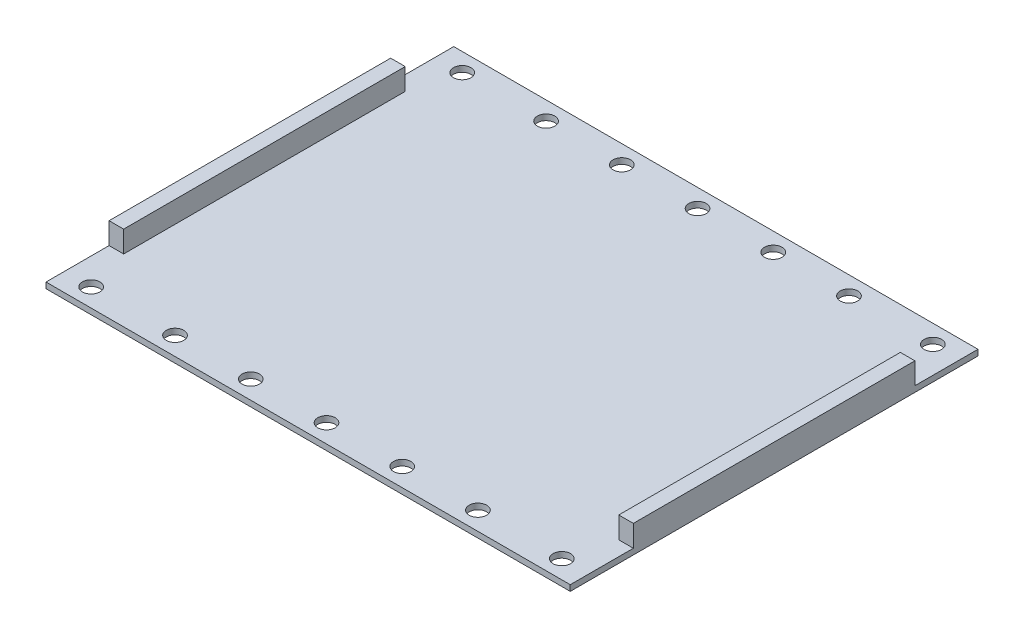
from build123d import *

# Parameters (mm, degrees)
SKETCH_1_W                 = 90
SKETCH_1_H                 = 70
SKETCH_1_R                 = 1.5
EXTRUDE_1_DEPTH            = 1
SKETCH_2_W                 = 2.5
SKETCH_2_H                 = 48.34
EXTRUDE_2_DEPTH            = 3.7
SKETCH_4_R                 = 1.5
CUT_EXTRUDE_1_DEPTH        = 10
PATTERN_LINEAR_1_COUNT     = 3
PATTERN_LINEAR_1_PITCH     = 13
PATTERN_LINEAR_1_COL_COUNT = 3
PATTERN_LINEAR_1_COL_PITCH = 13
MIRROR_2_COPY_1_SKETCH_R   = 1.5
MIRROR_2_COPY_1_DEPTH      = 10
MIRROR_2_COPY_2_SKETCH_R   = 1.5
MIRROR_2_COPY_2_DEPTH      = 10
MIRROR_2_COPY_3_SKETCH_R   = 1.5
MIRROR_2_COPY_3_DEPTH      = 10
MIRROR_2_COPY_4_SKETCH_R   = 1.5
MIRROR_2_COPY_4_DEPTH      = 10


with BuildPart() as part:
    # 草图1 → 凸台-拉伸1 (new body)
    with BuildSketch(Plane(origin=(0, 0, 0), x_dir=(1, 0, 0), z_dir=(0, 1, 0))):
        Rectangle(SKETCH_1_W, SKETCH_1_H)
        with Locations(Location((40.4, -31.85, 0), (0, 0, 270))):
            Circle(SKETCH_1_R, mode=Mode.SUBTRACT)
        with Locations(Location((-40.4, -31.85, 0), (0, 0, 90))):
            Circle(SKETCH_1_R, mode=Mode.SUBTRACT)
        with Locations(Location((40.4, 31.85, 0), (0, 0, 90))):
            Circle(SKETCH_1_R, mode=Mode.SUBTRACT)
        with Locations(Location((-40.4, 31.85, 0), (0, 0, 270))):
            Circle(SKETCH_1_R, mode=Mode.SUBTRACT)
    extrude(amount=EXTRUDE_1_DEPTH)

    # 草图2 → 凸台-拉伸2 (add)
    with BuildSketch(Plane(origin=(0, 1, 0), x_dir=(1, 0, 0), z_dir=(0, 1, 0))):
        with Locations((43.75, 0)):
            Rectangle(SKETCH_2_W, SKETCH_2_H)
    extrude_2 = extrude(amount=EXTRUDE_2_DEPTH)

    # 镜向1: 凸台-拉伸2 across plane
    add(extrude_2.mirror(Plane(origin=(0, 0, 0), x_dir=(0, 0, 1), z_dir=(1, 0, 0))))

    # 草图4 → 切除-拉伸1 (cut)
    with BuildSketch(Plane.XZ):
        with Locations(Location((0, 31.85, 0), (0, 0, 270))):
            Circle(SKETCH_4_R)
    cut_extrude_1 = extrude(amount=-CUT_EXTRUDE_1_DEPTH, mode=Mode.SUBTRACT)

    # 阵列(线性)1: 切除-拉伸1 ×3
    with Locations(*[(-i * PATTERN_LINEAR_1_PITCH, 0, 0) for i in range(1, PATTERN_LINEAR_1_COUNT)]):
        add(cut_extrude_1, mode=Mode.SUBTRACT)

    # 阵列(线性)1 col: 切除-拉伸1 ×3
    with Locations(*[(i * PATTERN_LINEAR_1_COL_PITCH, 0, 0) for i in range(1, PATTERN_LINEAR_1_COL_COUNT)]):
        add(cut_extrude_1, mode=Mode.SUBTRACT)

    # 镜向2: 切除-拉伸1 across plane
    add(cut_extrude_1.mirror(Plane.XY), mode=Mode.SUBTRACT)

    # 镜向2 copy 1 sketch → 镜向2 copy 1 (cut)
    with BuildSketch(Plane(origin=(-13, 0, 0), x_dir=(1, 0, 0), z_dir=(0, -1, 0))):
        with Locations((0, -31.85)):
            Circle(MIRROR_2_COPY_1_SKETCH_R)
    extrude(amount=-MIRROR_2_COPY_1_DEPTH, mode=Mode.SUBTRACT)

    # 镜向2 copy 2 sketch → 镜向2 copy 2 (cut)
    with BuildSketch(Plane(origin=(-26, 0, 0), x_dir=(1, 0, 0), z_dir=(0, -1, 0))):
        with Locations((0, -31.85)):
            Circle(MIRROR_2_COPY_2_SKETCH_R)
    extrude(amount=-MIRROR_2_COPY_2_DEPTH, mode=Mode.SUBTRACT)

    # 镜向2 copy 3 sketch → 镜向2 copy 3 (cut)
    with BuildSketch(Plane(origin=(13, 0, 0), x_dir=(1, 0, 0), z_dir=(0, -1, 0))):
        with Locations((0, -31.85)):
            Circle(MIRROR_2_COPY_3_SKETCH_R)
    extrude(amount=-MIRROR_2_COPY_3_DEPTH, mode=Mode.SUBTRACT)

    # 镜向2 copy 4 sketch → 镜向2 copy 4 (cut)
    with BuildSketch(Plane(origin=(26, 0, 0), x_dir=(1, 0, 0), z_dir=(0, -1, 0))):
        with Locations((0, -31.85)):
            Circle(MIRROR_2_COPY_4_SKETCH_R)
    extrude(amount=-MIRROR_2_COPY_4_DEPTH, mode=Mode.SUBTRACT)


solid = part.part
